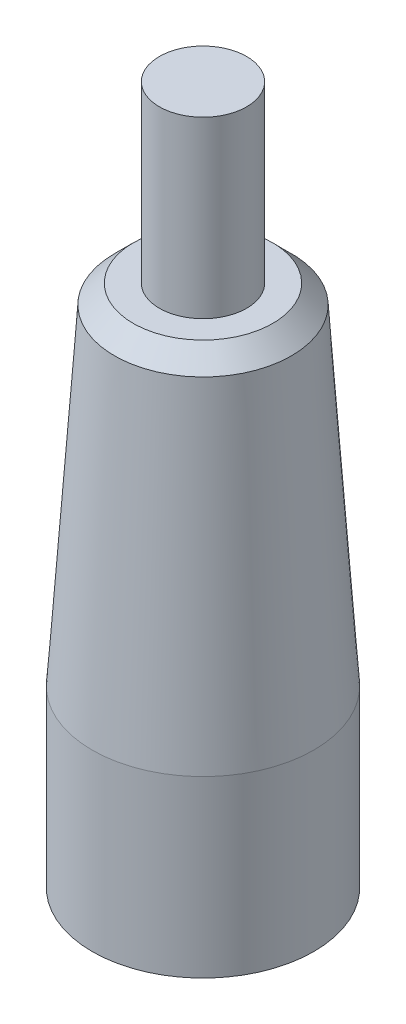
from build123d import *

# Parameters (mm, degrees)
CHAMFER3_SIZE  = 0.5
CHAMFER3_SIZE2 = 0.537413156


with BuildPart() as part:
    # Sketch4 → Revolve1 (revolve)
    with BuildSketch(Plane.XY):
        Polygon((0, 0), (0, 15), (0, 20), (1.25, 20), (1.25, 15), (2.5, 15), (3.175, 5), (3.175, 0), align=None)
    revolve(axis=Axis((0, 0, 0), (0, 1, 0)))

    # Chamfer3
    chamfer3_edges = [part.edges().sort_by_distance(p)[0] for p in [
        (-2.5, 15, 0),
    ]]
    chamfer3_side = [part.faces().sort_by_distance(p)[0] for p in [
        (-1.320710678, 15, 0),
    ]]
    chamfer(chamfer3_edges, length=CHAMFER3_SIZE, length2=CHAMFER3_SIZE2, reference=chamfer3_side[0])


solid = part.part
